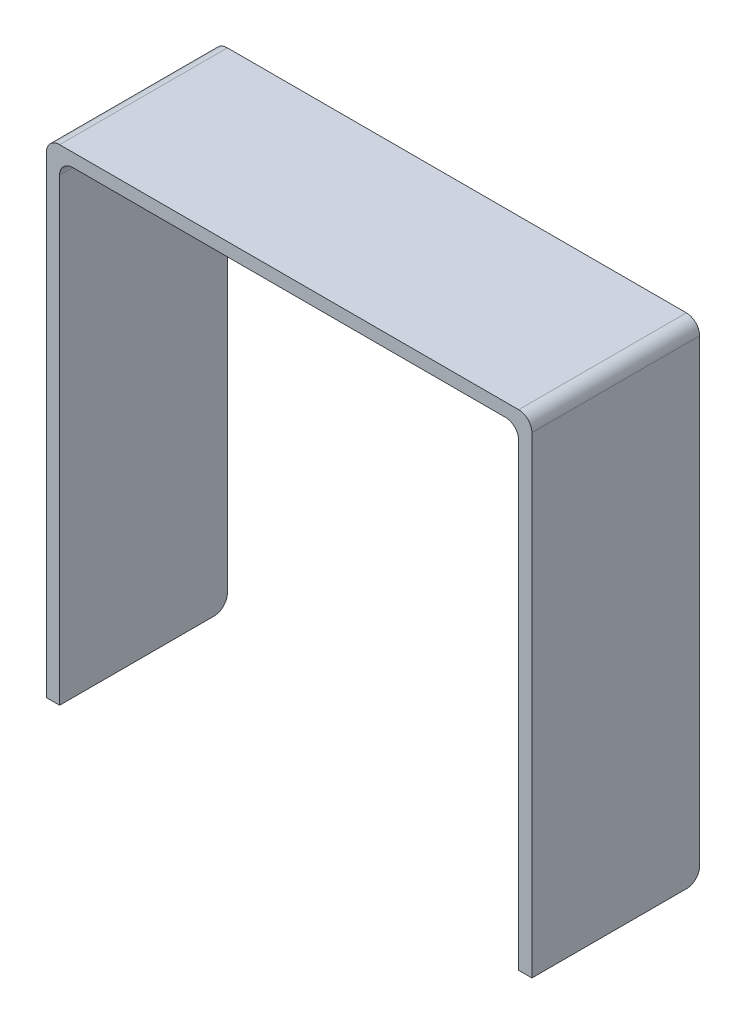
from build123d import *

# Parameters (mm, degrees)
SKETCH_1_W      = 3
SKETCH_1_H      = 38
SKETCH_1_W_2    = 104
EXTRUDE_1_DEPTH = 3
SKETCH_4_W      = 3
SKETCH_4_H      = 38
EXTRUDE_3_DEPTH = 107
FILLET_1_R      = 3
FILLET_2_R      = 3
FILLET_3_R      = 3
FILLET_5_R      = 3


with BuildPart() as part:
    # 草图1 → 凸台-拉伸1 (new body)
    with BuildSketch(Plane(origin=(0, 0, 0), x_dir=(1, 0, 0), z_dir=(0, 1, 0))):
        with Locations((-53.5, 0)):
            Rectangle(SKETCH_1_W, SKETCH_1_H)
        Rectangle(SKETCH_1_W_2, SKETCH_1_H)
        with Locations((53.5, 0)):
            Rectangle(SKETCH_1_W, SKETCH_1_H)
    extrude(amount=EXTRUDE_1_DEPTH)

    # 草图4 → 凸台-拉伸3 (add)
    with BuildSketch(Plane.XZ):
        with Locations((53.5, 0)):
            Rectangle(SKETCH_4_W, SKETCH_4_H)
        with Locations((-53.5, 0)):
            Rectangle(SKETCH_4_W, SKETCH_4_H)
    extrude(amount=EXTRUDE_3_DEPTH)

    # 圆角1
    fillet_1_edges = [part.edges().sort_by_distance(p)[0] for p in [
        (-55, 3, 0),
        (55, 3, 0),
    ]]
    fillet(fillet_1_edges, radius=FILLET_1_R)

    # 圆角2
    fillet_2_edges = [part.edges().sort_by_distance(p)[0] for p in [
        (52, 0, 0),
    ]]
    fillet(fillet_2_edges, radius=FILLET_2_R)

    # 圆角3
    fillet_3_edges = [part.edges().sort_by_distance(p)[0] for p in [
        (-52, 0, 0),
    ]]
    fillet(fillet_3_edges, radius=FILLET_3_R)

    # 圆角5
    fillet_5_edges = [part.edges().sort_by_distance(p)[0] for p in [
        (53.5, -107, -19),
        (-53.5, -107, -19),
    ]]
    fillet(fillet_5_edges, radius=FILLET_5_R)


solid = part.part
